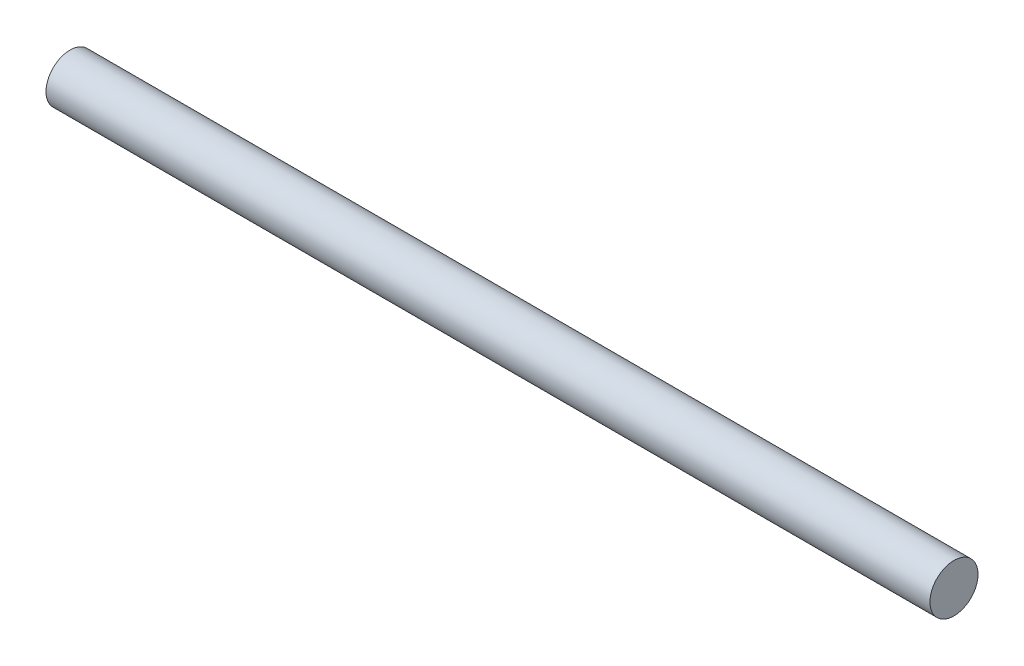
from build123d import *

# Parameters (mm, degrees)
SKETCH1_R           = 3.1
BOSS_EXTRUDE1_DEPTH = 114


with BuildPart() as part:
    # Sketch1 → Boss-Extrude1 (new body)
    with BuildSketch(Plane(origin=(0, 0, 0), x_dir=(0, 0, -1), z_dir=(1, 0, 0))):
        with Locations(Location((0, 0, 0), (0, 0, 180))):
            Circle(SKETCH1_R)
    extrude(amount=BOSS_EXTRUDE1_DEPTH)


solid = part.part
